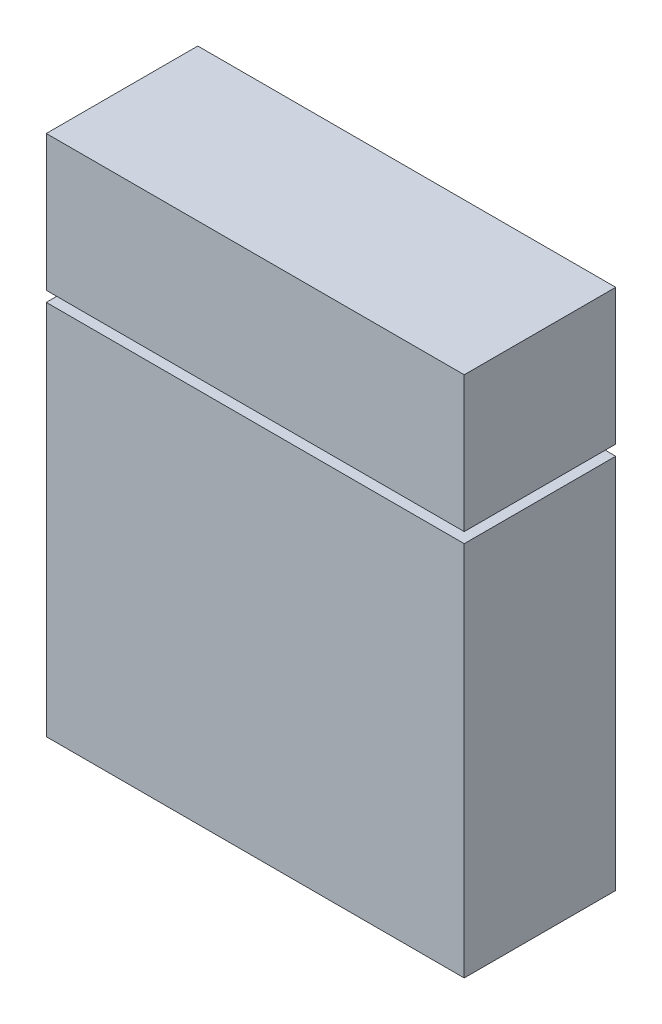
from build123d import *

# Parameters (mm, degrees)
SKETCH1_W           = 40
SKETCH1_H           = 14.5
BOSS_EXTRUDE1_DEPTH = 36
SHELL1_T            = -2
SKETCH3_W           = 40
SKETCH3_H           = 13
BOSS_EXTRUDE3_DEPTH = 14.5
SHELL2_T            = -1
SKETCH2_W           = 38
SKETCH2_H           = 12.5
SKETCH2_W_2         = 36
SKETCH2_H_2         = 10.5
BOSS_EXTRUDE2_DEPTH = 8
SKETCH4_W           = 2.411172945
SKETCH4_H           = 0.95890411
BOSS_EXTRUDE4_DEPTH = 0.6


with BuildPart() as part:
    # Sketch1 → Boss-Extrude1 (new body)
    with BuildSketch(Plane(origin=(0, 0, 0), x_dir=(1, 0, 0), z_dir=(0, 1, 0))):
        with Locations((20, 7.25)):
            Rectangle(SKETCH1_W, SKETCH1_H)
    extrude(amount=BOSS_EXTRUDE1_DEPTH)

    # Shell1
    shell1_openings = [part.faces().sort_by_distance(p)[0] for p in [
        (20, 36, -7.25),
    ]]
    offset(amount=SHELL1_T, openings=shell1_openings, kind=Kind.INTERSECTION)

    # Sketch2 → Boss-Extrude2 (add)
    with BuildSketch(Plane(origin=(0, 36, 0), x_dir=(1, 0, 0), z_dir=(0, 1, 0))):
        with Locations((20, 7.25)):
            Rectangle(SKETCH2_W, SKETCH2_H)
        with Locations((20, 7.25)):
            Rectangle(SKETCH2_W_2, SKETCH2_H_2, mode=Mode.SUBTRACT)
    extrude(amount=BOSS_EXTRUDE2_DEPTH)

    # Sketch4 → Boss-Extrude4 (add)
    # profile 1 of 13: a face of its own
    with BuildSketch(Plane(origin=(0, 0, -14.5), x_dir=(-1, 0, 0), z_dir=(0, 0, -1))):
        Polygon((-33.111087329, 25.911115248), (-31.298159247, 28.40576422), (-33.007277397, 30.842622097), (-31.609589041, 30.842622097), (-30.60359589, 29.373229974), (-29.590111301, 30.842622097), (-28.19135274, 30.842622097), (-29.90047089, 28.40576422), (-28.088613014, 25.911115248), (-29.493792808, 25.911115248), (-30.60359589, 27.4447197), (-31.705907534, 25.911115248), align=None)
    # profile 2 of 13: a face of its own
    with BuildSketch(Plane(origin=(0, 0, -14.5), x_dir=(-1, 0, 0), z_dir=(0, 0, -1))):
        with Locations((-26.664704624, 27.760430316)):
            Rectangle(SKETCH4_W, SKETCH4_H)
    # profile 3 of 13: a face of its own
    with BuildSketch(Plane(origin=(0, 0, -14.5), x_dir=(-1, 0, 0), z_dir=(0, 0, -1))):
        Polygon((-25.270761986, 25.911115248), (-23.400042808, 30.842622097), (-22.112585616, 30.842622097), (-20.240796233, 25.911115248), (-21.513270548, 25.911115248), (-21.809717466, 26.801526206), (-23.702910959, 26.801526206), (-23.999357877, 25.911115248), align=None)
        Polygon((-23.385059932, 27.760430316), (-22.127568493, 27.760430316), (-22.763270548, 29.608675179), align=None, mode=Mode.SUBTRACT)
    # profile 4 of 13: a face of its own
    with BuildSketch(Plane(origin=(0, 0, -14.5), x_dir=(-1, 0, 0), z_dir=(0, 0, -1))):
        with BuildLine():
            add(Edge.make_bspline(
                [(-17.441138699, 25.842622097), (-17.504319594, 25.843193709), (-17.628372588, 25.844316046), (-17.810813513, 25.860573692), (-17.986880937, 25.882935729), (-18.156032855, 25.917990004), (-18.318901219, 25.960200334), (-18.47507591, 26.012594344), (-18.623672758, 26.07638442), (-18.766570471, 26.147515716), (-18.900935636, 26.229171373), (-19.028485234, 26.318161499), (-19.146828485, 26.416751157), (-19.257463015, 26.522862991), (-19.359717753, 26.637038589), (-19.45400103, 26.759451881), (-19.54102985, 26.890071418), (-19.618545791, 27.029269857), (-19.688773597, 27.175108322), (-19.748239925, 27.328064232), (-19.798710374, 27.487558318), (-19.840432062, 27.652979125), (-19.872230804, 27.824988227), (-19.895982407, 28.003177736), (-19.910053127, 28.187925883), (-19.911506861, 28.313345771), (-19.912243151, 28.376868672)],
                knots=[0, 0, 0, 0, 1.134302944, 2.227155484, 3.287291634, 4.320127596, 5.327125488, 6.307730235, 7.275186614, 8.229313452, 9.172057786, 10.09635632, 11.020032909, 11.935339152, 12.84729825, 13.769974407, 14.708201451, 15.663424702, 16.629161195, 17.613088159, 18.607967803, 19.631982939, 20.674943435, 21.747780889, 22.859291827, 24, 24, 24, 24], degree=3))
            add(Edge.make_bspline(
                [(-19.912243151, 28.376868672), (-19.911661686, 28.440405398), (-19.910516642, 28.565524656), (-19.894291005, 28.749749349), (-19.871916865, 28.927945782), (-19.836909107, 29.09925222), (-19.794446192, 29.2645251), (-19.742531301, 29.423347725), (-19.678277513, 29.574624146), (-19.607230674, 29.720142734), (-19.526670907, 29.858490484), (-19.43803536, 29.989343936), (-19.340371384, 30.111413152), (-19.234999876, 30.2252785), (-19.12231325, 30.33140625), (-19.002325505, 30.430435582), (-18.873447028, 30.520521639), (-18.736439653, 30.601367514), (-18.592984345, 30.674511024), (-18.442709701, 30.73764837), (-18.286085101, 30.791226235), (-18.123356553, 30.834918872), (-17.954319692, 30.869313027), (-17.779220629, 30.893919505), (-17.597606317, 30.907578102), (-17.474693426, 30.909923556), (-17.412243151, 30.911115248)],
                knots=[0, 0, 0, 0, 1.137471579, 2.239958052, 3.309751485, 4.352183102, 5.368685638, 6.364684256, 7.341170057, 8.309744883, 9.263050222, 10.205742738, 11.137635889, 12.059909495, 12.981873265, 13.907856827, 14.843661702, 15.794695171, 16.754698838, 17.725294248, 18.711222551, 19.717008084, 20.740652763, 21.798649287, 22.881525306, 24, 24, 24, 24], degree=3))
            add(Edge.make_bspline(
                [(-17.412243151, 30.911115248), (-17.354429504, 30.909922137), (-17.240777073, 30.907576673), (-17.073027806, 30.89397778), (-16.911168182, 30.869066578), (-16.754836958, 30.835146284), (-16.604361283, 30.790945103), (-16.459187414, 30.737702842), (-16.320469642, 30.673104204), (-16.187240747, 30.600493534), (-16.061432354, 30.518577342), (-15.940957375, 30.431670981), (-15.830129759, 30.335606931), (-15.725206149, 30.234992947), (-15.62880588, 30.126134708), (-15.53931037, 30.01114128), (-15.456829525, 29.889511911), (-15.409255368, 29.803833511), (-15.385273973, 29.760644357)],
                knots=[0, 0, 0, 0, 1.130888133, 2.223146121, 3.288895887, 4.331788187, 5.349661884, 6.354150794, 7.35317223, 8.33993527, 9.319269624, 10.287806577, 11.242904509, 12.185379447, 13.129299661, 14.083964217, 15.034156054, 16, 16, 16, 16], degree=3))
            Line((-15.385273973, 29.760644357), (-16.421232877, 29.390353261))
            add(Edge.make_bspline(
                [(-16.421232877, 29.390353261), (-16.449434367, 29.438047974), (-16.504579819, 29.531310651), (-16.609283842, 29.652070339), (-16.729499241, 29.750850541), (-16.863492812, 29.825573931), (-17.00516507, 29.881553417), (-17.150258202, 29.922984438), (-17.29873729, 29.946697819), (-17.398608094, 29.95037124), (-17.448630137, 29.952211138)],
                knots=[0, 0, 0, 0, 1.077332688, 2.106626201, 3.093969042, 4.092635605, 5.08078461, 6.055063824, 7.025844628, 8, 8, 8, 8], degree=3))
            add(Edge.make_bspline(
                [(-17.448630137, 29.952211138), (-17.504452459, 29.949930065), (-17.614323997, 29.945440373), (-17.77556992, 29.910187966), (-17.928428786, 29.850374895), (-18.073652148, 29.768781211), (-18.207644108, 29.665096763), (-18.326677032, 29.538591331), (-18.430943293, 29.391653486), (-18.519493453, 29.224448198), (-18.590110412, 29.037886912), (-18.641490711, 28.833314785), (-18.670973679, 28.610672893), (-18.67509631, 28.456508657), (-18.677226027, 28.376868672)],
                knots=[0, 0, 0, 0, 0.897880113, 1.7672405, 2.64153505, 3.531005305, 4.43941526, 5.357247272, 6.316333764, 7.330870984, 8.393958058, 9.519093982, 10.718384218, 12, 12, 12, 12], degree=3))
            add(Edge.make_bspline(
                [(-18.677226027, 28.376868672), (-18.676374872, 28.314750078), (-18.674722867, 28.194184379), (-18.656968062, 28.019357006), (-18.62989286, 27.855642813), (-18.590065726, 27.703199369), (-18.540100702, 27.561517277), (-18.479181436, 27.430924756), (-18.405910995, 27.312006287), (-18.321051329, 27.205775634), (-18.229686169, 27.109870915), (-18.130193527, 27.028860885), (-18.027376449, 26.958035299), (-17.918447865, 26.901750692), (-17.805373859, 26.8552427), (-17.68596601, 26.825472564), (-17.562066118, 26.804922703), (-17.477613259, 26.802670273), (-17.434717466, 26.801526206)],
                knots=[0, 0, 0, 0, 1.321923538, 2.565715426, 3.736787918, 4.851159748, 5.915232172, 6.93097327, 7.913055684, 8.880852609, 9.820715951, 10.726934296, 11.60736189, 12.473558546, 13.332366679, 14.203608668, 15.087566354, 16, 16, 16, 16], degree=3))
            add(Edge.make_bspline(
                [(-17.434717466, 26.801526206), (-17.387197421, 26.803079073), (-17.291336609, 26.806211624), (-17.146494436, 26.82857456), (-16.999774743, 26.865465686), (-16.852252291, 26.915113527), (-16.709506327, 26.984356125), (-16.582216006, 27.081346079), (-16.469956383, 27.202221813), (-16.413102553, 27.297951057), (-16.383775685, 27.347331001)],
                knots=[0, 0, 0, 0, 0.91565894, 1.8471323, 2.81759887, 3.828618231, 4.843254429, 5.859403534, 6.895817748, 8, 8, 8, 8], degree=3))
            Line((-16.383775685, 27.347331001), (-15.355308219, 26.9759697))
            add(Edge.make_bspline(
                [(-15.355308219, 26.9759697), (-15.380692787, 26.933089767), (-15.431103832, 26.847934797), (-15.518231614, 26.728012864), (-15.61010549, 26.612756914), (-15.713388626, 26.507435265), (-15.820880419, 26.405711554), (-15.938399421, 26.312610056), (-16.063580233, 26.226442315), (-16.194899308, 26.145782234), (-16.332905713, 26.074179243), (-16.47666579, 26.011955186), (-16.625504857, 25.959658715), (-16.779197642, 25.91664519), (-16.93760855, 25.883506529), (-17.101013587, 25.860489636), (-17.269227772, 25.844395436), (-17.383308509, 25.843218641), (-17.441138699, 25.842622097)],
                knots=[0, 0, 0, 0, 0.959546369, 1.905556723, 2.853412952, 3.796472408, 4.744801998, 5.703363206, 6.681439113, 7.671611824, 8.670713748, 9.674297559, 10.68729874, 11.707896229, 12.747207531, 13.802822661, 14.886199502, 16, 16, 16, 16], degree=3))
        make_face()
    # profile 5 of 13: a face of its own
    with BuildSketch(Plane(origin=(0, 0, -14.5), x_dir=(-1, 0, 0), z_dir=(0, 0, -1))):
        Polygon((-13.469606164, 25.911115248), (-13.469606164, 29.815224837), (-15.059931507, 29.815224837), (-15.059931507, 30.842622097), (-10.718107877, 30.842622097), (-10.718107877, 29.815224837), (-12.308433219, 29.815224837), (-12.308433219, 25.911115248), align=None)
    # profile 6 of 13: a face of its own
    with BuildSketch(Plane(origin=(0, 0, -14.5), x_dir=(-1, 0, 0), z_dir=(0, 0, -1))):
        with BuildLine():
            add(Edge.make_bspline(
                [(-7.764340753, 25.842622097), (-7.826435684, 25.843807607), (-7.948638756, 25.846140695), (-8.129167343, 25.859884761), (-8.304028254, 25.884284407), (-8.473176931, 25.920179835), (-8.637398821, 25.963717531), (-8.796358201, 26.017152564), (-8.949324975, 26.081421204), (-9.096041889, 26.155520523), (-9.236371271, 26.23778657), (-9.369366697, 26.328586668), (-9.493621484, 26.428716653), (-9.610566526, 26.535911883), (-9.71997722, 26.650382585), (-9.821072816, 26.773160431), (-9.914276598, 26.904112675), (-9.999723134, 27.042654814), (-10.075719809, 27.188640343), (-10.142515695, 27.340742245), (-10.197614843, 27.499516083), (-10.24412335, 27.663399483), (-10.279074722, 27.833379635), (-10.304990656, 28.009127999), (-10.319903705, 28.191107736), (-10.322093112, 28.314413736), (-10.323202055, 28.376868672)],
                knots=[0, 0, 0, 0, 1.103579979, 2.171849834, 3.215473578, 4.238776472, 5.242989064, 6.233378138, 7.216537329, 8.189029907, 9.152386999, 10.105488514, 11.048073661, 11.985870825, 12.923067772, 13.859814304, 14.809790056, 15.777518025, 16.750155247, 17.73247601, 18.726995941, 19.734564975, 20.757867869, 21.808668853, 22.890082825, 24, 24, 24, 24], degree=3))
            add(Edge.make_bspline(
                [(-10.323202055, 28.376868672), (-10.322093357, 28.439323695), (-10.319904433, 28.562629865), (-10.304987866, 28.744608362), (-10.279084752, 28.920361247), (-10.244087193, 29.090325107), (-10.197838463, 29.253943836), (-10.142265275, 29.41219234), (-10.075754028, 29.564040765), (-9.999700003, 29.709996983), (-9.914334448, 29.848601378), (-9.820709143, 29.979563076), (-9.72036847, 30.103325705), (-9.610464895, 30.21771969), (-9.493992057, 30.325123568), (-9.36898823, 30.423962752), (-9.236426398, 30.514952897), (-9.096019184, 30.597104346), (-8.949360375, 30.671343041), (-8.79613147, 30.735208234), (-8.637631239, 30.790344242), (-8.473143679, 30.833460246), (-8.304037422, 30.869479755), (-8.129164816, 30.893845191), (-7.948639419, 30.907598588), (-7.826435907, 30.909930391), (-7.764340753, 30.911115248)],
                knots=[0, 0, 0, 0, 1.110055208, 2.191603668, 3.242535334, 4.265965488, 5.273659827, 6.262323585, 7.244766512, 8.217524695, 9.185373013, 10.135466908, 11.077230586, 12.014544085, 12.952457877, 13.891207151, 14.844427197, 15.807904095, 16.780517616, 17.763799076, 18.756358901, 19.76069638, 20.784126535, 21.827880067, 22.896282776, 24, 24, 24, 24], degree=3))
            add(Edge.make_bspline(
                [(-7.764340753, 30.911115248), (-7.701889317, 30.909923156), (-7.578618466, 30.907570127), (-7.396314455, 30.893834484), (-7.219648448, 30.869559601), (-7.049430816, 30.833634694), (-6.884349552, 30.790116361), (-6.72533158, 30.735453082), (-6.571837932, 30.671315433), (-6.425175818, 30.597101956), (-6.28473622, 30.514989131), (-6.152074122, 30.423663849), (-6.026175369, 30.325124609), (-5.908588838, 30.218089145), (-5.798723388, 30.102981715), (-5.697305091, 29.979592109), (-5.602425487, 29.848944769), (-5.517421792, 29.709687083), (-5.439992568, 29.564126807), (-5.372635255, 29.412186455), (-5.315510475, 29.254178738), (-5.270038665, 29.090148453), (-5.233148278, 28.920523552), (-5.207753495, 28.744583598), (-5.192694542, 28.562636323), (-5.190525166, 28.439325866), (-5.18942637, 28.376868672)],
                knots=[0, 0, 0, 0, 1.106823481, 2.184722734, 3.237959271, 4.264599291, 5.266012822, 6.261662314, 7.242081126, 8.211863057, 9.172534965, 10.122979882, 11.063957728, 12.003809277, 12.938393956, 13.881429653, 14.832442119, 15.797472721, 16.770340844, 17.752470401, 18.740382193, 19.74514281, 20.766904726, 21.814776793, 22.893176519, 24, 24, 24, 24], degree=3))
            add(Edge.make_bspline(
                [(-5.18942637, 28.376868672), (-5.190525416, 28.314411568), (-5.192695283, 28.191101287), (-5.207750653, 28.009152726), (-5.233158501, 27.833217461), (-5.270001781, 27.663575654), (-5.315734834, 27.499283164), (-5.372381765, 27.340745343), (-5.440027334, 27.18855474), (-5.517398572, 27.042964505), (-5.602483169, 26.903769637), (-5.69694021, 26.773127333), (-5.799113147, 26.650728597), (-5.908487417, 26.535541762), (-6.026545743, 26.428719217), (-6.151697996, 26.328884536), (-6.284790877, 26.237750315), (-6.425153344, 26.15552307), (-6.571872879, 26.081448195), (-6.725106809, 26.016908983), (-6.884579933, 25.963943958), (-7.049397795, 25.920005404), (-7.219657636, 25.884204802), (-7.396311915, 25.859895383), (-7.578619127, 25.846169164), (-7.701889539, 25.843814843), (-7.764340753, 25.842622097)],
                knots=[0, 0, 0, 0, 1.106686263, 2.184952294, 3.232694451, 4.254329694, 5.258965746, 6.252704014, 7.234711811, 8.207459324, 9.172370285, 10.12326485, 11.06131876, 11.995787575, 12.935522606, 13.880304198, 14.830631284, 15.791184092, 16.760845795, 17.74114306, 18.734640031, 19.735929413, 20.762442155, 21.815548117, 22.893313737, 24, 24, 24, 24], degree=3))
        make_face()
        with BuildLine():
            add(Edge.make_bspline(
                [(-7.764340753, 26.801526206), (-7.704938985, 26.803318569), (-7.587604506, 26.806858968), (-7.416089564, 26.843067918), (-7.251764804, 26.898591453), (-7.095901595, 26.977121272), (-6.951383074, 27.0775307), (-6.820892511, 27.20029185), (-6.707745718, 27.345367221), (-6.608088058, 27.509817116), (-6.529023219, 27.696759522), (-6.470973766, 27.904791701), (-6.438749764, 28.134357102), (-6.434263408, 28.294007883), (-6.431934932, 28.376868672)],
                knots=[0, 0, 0, 0, 0.921217794, 1.819653054, 2.709560437, 3.608832094, 4.52008632, 5.433157136, 6.379611243, 7.368572108, 8.410889379, 9.521064577, 10.713400929, 12, 12, 12, 12], degree=3))
            add(Edge.make_bspline(
                [(-6.431934932, 28.376868672), (-6.434261098, 28.459731033), (-6.438743006, 28.619384842), (-6.470997799, 28.848929284), (-6.528941935, 29.057033152), (-6.608485668, 29.244013726), (-6.70697238, 29.409302437), (-6.82172385, 29.553373402), (-6.950600463, 29.677509011), (-7.096323377, 29.776391525), (-7.251701619, 29.855229246), (-7.416106504, 29.910647078), (-7.587600128, 29.946884152), (-7.704937513, 29.950420716), (-7.764340753, 29.952211138)],
                knots=[0, 0, 0, 0, 1.286484825, 2.478715302, 3.588791919, 4.631016636, 5.624640673, 6.566672884, 7.483468754, 8.391488359, 9.290680163, 10.180508525, 11.078864007, 12, 12, 12, 12], degree=3))
            add(Edge.make_bspline(
                [(-7.764340753, 29.952211138), (-7.822680002, 29.950434034), (-7.937908747, 29.946923989), (-8.106839904, 29.91034968), (-8.269715894, 29.854952896), (-8.424793454, 29.776785887), (-8.569636836, 29.676778595), (-8.699514434, 29.55381747), (-8.814176841, 29.409238794), (-8.912637838, 29.24401032), (-8.992545876, 29.05720975), (-9.048747338, 28.848728232), (-9.081486026, 28.619414781), (-9.085896065, 28.459741263), (-9.088184932, 28.376868672)],
                knots=[0, 0, 0, 0, 0.907584157, 1.792614509, 2.680171409, 3.582379695, 4.488874192, 5.41278275, 6.357975157, 7.354932463, 8.400653488, 9.512969455, 10.709199458, 12, 12, 12, 12], degree=3))
            add(Edge.make_bspline(
                [(-9.088184932, 28.376868672), (-9.085893758, 28.293997653), (-9.081479274, 28.134327163), (-9.048771336, 27.904992763), (-8.992464789, 27.696582838), (-8.913035805, 27.509820386), (-8.813404067, 27.345430739), (-8.700346905, 27.199843889), (-8.568854154, 27.078261678), (-8.425217186, 26.976727228), (-8.269652772, 26.898867387), (-8.106856553, 26.843365789), (-7.937904466, 26.80681898), (-7.822678563, 26.803305201), (-7.764340753, 26.801526206)],
                knots=[0, 0, 0, 0, 1.290912043, 2.487245376, 3.599657426, 4.645468781, 5.637744867, 6.587371702, 7.507557596, 8.417310857, 9.319597076, 10.207230643, 11.092337445, 12, 12, 12, 12], degree=3))
        make_face(mode=Mode.SUBTRACT)
    # profile 7 of 13: a face of its own
    with BuildSketch(Plane(origin=(0, 0, -14.5), x_dir=(-1, 0, 0), z_dir=(0, 0, -1))):
        Polygon((-24.077482877, 15.733033056), (-23.943707192, 16.691937165), (-24.890839041, 16.691937165), (-24.743150685, 17.719334426), (-23.796018836, 17.719334426), (-23.648330479, 18.678238535), (-24.595462329, 18.678238535), (-24.446703767, 19.705635795), (-23.500642123, 19.705635795), (-23.359375, 20.664539905), (-22.324486301, 20.664539905), (-22.464683219, 19.705635795), (-21.45119863, 19.705635795), (-21.311001712, 20.664539905), (-20.26755137, 20.664539905), (-20.407748288, 19.705635795), (-19.454195205, 19.705635795), (-19.609375, 18.678238535), (-20.556506849, 18.678238535), (-20.696703767, 17.719334426), (-19.749571918, 17.719334426), (-19.898330479, 16.691937165), (-20.851883562, 16.691937165), (-20.985659247, 15.733033056), (-22.028039384, 15.733033056), (-21.895333904, 16.691937165), (-22.901327055, 16.691937165), (-23.034032534, 15.733033056), align=None)
        Polygon((-22.753638699, 17.719334426), (-21.74015411, 17.719334426), (-21.598886986, 18.678238535), (-22.612371575, 18.678238535), align=None, mode=Mode.SUBTRACT)
    # profile 8 of 13: a face of its own
    with BuildSketch(Plane(origin=(0, 0, -14.5), x_dir=(-1, 0, 0), z_dir=(0, 0, -1))):
        with BuildLine():
            Line((-18.995077055, 15.733033056), (-18.995077055, 16.623444015))
            add(Edge.make_bspline(
                [(-18.995077055, 16.623444015), (-18.915831423, 16.679022575), (-18.760975158, 16.787630308), (-18.535222887, 16.947762501), (-18.322687406, 17.102122403), (-18.121656668, 17.248255294), (-17.935104117, 17.390273037), (-17.758708923, 17.523173003), (-17.596808595, 17.652342733), (-17.444642404, 17.772805752), (-17.305424902, 17.890266103), (-17.175453548, 18.002490657), (-17.055600871, 18.111364164), (-16.946165007, 18.217169348), (-16.847894167, 18.320181266), (-16.758514205, 18.418599554), (-16.679401056, 18.513425329), (-16.610094021, 18.605215158), (-16.549789329, 18.694565506), (-16.496999401, 18.782124104), (-16.452794212, 18.868961477), (-16.417628745, 18.954705537), (-16.389599733, 19.038338452), (-16.368524155, 19.12045507), (-16.356723128, 19.201580842), (-16.354769414, 19.255402319), (-16.353809932, 19.281834426)],
                knots=[0, 0, 0, 0, 1.811704495, 3.540306081, 5.180447559, 6.728302311, 8.191933421, 9.568797882, 10.861886385, 12.068396724, 13.201168436, 14.27088458, 15.282375238, 16.231490338, 17.119321911, 17.946665833, 18.719512314, 19.429959585, 20.098506126, 20.736337521, 21.342523323, 21.920355032, 22.469342971, 22.992422251, 23.505171484, 24, 24, 24, 24], degree=3))
            add(Edge.make_bspline(
                [(-16.353809932, 19.281834426), (-16.356033021, 19.326734777), (-16.360305113, 19.413019391), (-16.399633915, 19.533417762), (-16.465121214, 19.636731792), (-16.556593926, 19.717747881), (-16.662594901, 19.781173743), (-16.77871373, 19.828302654), (-16.90412713, 19.854930353), (-16.9904613, 19.858828791), (-17.034460616, 19.86081559)],
                knots=[0, 0, 0, 0, 1.0714191, 2.058936774, 2.99144009, 3.963690835, 4.951392785, 5.935291678, 6.947742779, 8, 8, 8, 8], degree=3))
            add(Edge.make_bspline(
                [(-17.034460616, 19.86081559), (-17.072753373, 19.859059292), (-17.149755698, 19.855527578), (-17.264481778, 19.829935706), (-17.377431445, 19.787290419), (-17.469485004, 19.739898311), (-17.540897761, 19.693132428), (-17.588896689, 19.647865347), (-17.634332736, 19.598108571), (-17.673880479, 19.539979486), (-17.710761698, 19.476032299), (-17.741048549, 19.403813808), (-17.768326213, 19.325259281), (-17.781921785, 19.269838606), (-17.788955479, 19.241166617)],
                knots=[0, 0, 0, 0, 1.292999032, 2.600072241, 3.949832351, 5.361949882, 6.090579869, 6.824175362, 7.583737363, 8.362648952, 9.193694582, 10.073461348, 11.003301643, 12, 12, 12, 12], degree=3))
            Line((-17.788955479, 19.241166617), (-18.809931507, 19.60503648))
            add(Edge.make_bspline(
                [(-18.809931507, 19.60503648), (-18.792485512, 19.649599799), (-18.758105679, 19.737418201), (-18.694291032, 19.861816562), (-18.622230622, 19.978958201), (-18.539766235, 20.087191991), (-18.449758857, 20.189055555), (-18.349351488, 20.280944335), (-18.240835076, 20.366140876), (-18.123215884, 20.442794463), (-17.998572724, 20.510863768), (-17.868262946, 20.569967635), (-17.733070188, 20.620294703), (-17.592995627, 20.662086399), (-17.447806211, 20.694406252), (-17.297541712, 20.716291294), (-17.14213035, 20.73098121), (-17.03663585, 20.732342245), (-16.983090753, 20.733033056)],
                knots=[0, 0, 0, 0, 1.00036352, 1.971359609, 2.91961612, 3.873141413, 4.813705766, 5.758786908, 6.715488637, 7.696381028, 8.691388109, 9.683060792, 10.686424742, 11.706215145, 12.738025682, 13.794256734, 14.880446488, 16, 16, 16, 16], degree=3))
            add(Edge.make_bspline(
                [(-16.983090753, 20.733033056), (-16.901304472, 20.730962293), (-16.741403087, 20.726913719), (-16.508224531, 20.695773353), (-16.288231454, 20.642872742), (-16.081666341, 20.571135344), (-15.892218426, 20.478207739), (-15.72113094, 20.366739434), (-15.574081039, 20.232395274), (-15.468264636, 20.106233876), (-15.396821055, 19.995934348), (-15.349265746, 19.908652631), (-15.311621544, 19.815454575), (-15.277292318, 19.719567618), (-15.253577273, 19.618179538), (-15.234919219, 19.512860111), (-15.224180746, 19.402635233), (-15.223134635, 19.327518792), (-15.22260274, 19.289325864)],
                knots=[0, 0, 0, 0, 1.530556104, 2.992409433, 4.393319662, 5.759685909, 7.076619037, 8.33409609, 9.567949726, 10.791370236, 11.40440925, 12.02579177, 12.648321283, 13.283927523, 13.930108215, 14.594255026, 15.285249454, 16, 16, 16, 16], degree=3))
            add(Edge.make_bspline(
                [(-15.22260274, 19.289325864), (-15.224460553, 19.227503107), (-15.228164348, 19.104251289), (-15.25794653, 18.921107893), (-15.307617887, 18.741547715), (-15.376676988, 18.565213156), (-15.464788531, 18.392403927), (-15.573150211, 18.223293398), (-15.700597143, 18.057519786), (-15.848319986, 17.896033495), (-16.013270544, 17.737487942), (-16.190316216, 17.576316934), (-16.383701778, 17.417514216), (-16.590426852, 17.257596863), (-16.812134152, 17.09863491), (-17.047889277, 16.938918405), (-17.298183627, 16.779585341), (-17.471553708, 16.676164315), (-17.559931507, 16.623444015)],
                knots=[0, 0, 0, 0, 0.800579642, 1.596061063, 2.39657401, 3.21014667, 4.045133991, 4.905368571, 5.808443174, 6.750683216, 7.737647826, 8.771598012, 9.851468923, 10.978270572, 12.156948619, 13.384888121, 14.666910507, 16, 16, 16, 16], degree=3))
            Line((-17.559931507, 16.623444015), (-15.200128425, 16.623444015))
            Line((-15.200128425, 16.623444015), (-15.200128425, 15.733033056))
            Line((-15.200128425, 15.733033056), (-18.995077055, 15.733033056))
        make_face()
    # profile 9 of 13: a face of its own
    with BuildSketch(Plane(origin=(0, 0, -14.5), x_dir=(-1, 0, 0), z_dir=(0, 0, -1))):
        with BuildLine():
            Line((-28.466395548, 5.162185453), (-29.273330479, 5.923101549))
            add(Edge.make_bspline(
                [(-29.273330479, 5.923101549), (-29.326879317, 5.887696934), (-29.434245553, 5.816710141), (-29.608195914, 5.73083788), (-29.787507183, 5.653398663), (-29.976644974, 5.593008582), (-30.173461795, 5.543992218), (-30.379530817, 5.512530392), (-30.593078315, 5.48924837), (-30.738373901, 5.487398662), (-30.812285959, 5.486457713)],
                knots=[0, 0, 0, 0, 0.947512456, 1.899776943, 2.861041691, 3.831065722, 4.829412731, 5.854447791, 6.90855474, 8, 8, 8, 8], degree=3))
            add(Edge.make_bspline(
                [(-30.812285959, 5.486457713), (-30.874380889, 5.487643223), (-30.996583961, 5.489976311), (-31.177112549, 5.503720377), (-31.35197346, 5.528120024), (-31.521122136, 5.564015451), (-31.685344026, 5.607553147), (-31.844303407, 5.66098818), (-31.99727018, 5.72525682), (-32.143987094, 5.79935614), (-32.284316476, 5.881622186), (-32.417311903, 5.972422285), (-32.54156669, 6.07255227), (-32.658511732, 6.1797475), (-32.767922425, 6.294218202), (-32.869018021, 6.416996048), (-32.962221803, 6.547948291), (-33.047668339, 6.68649043), (-33.123665014, 6.832475959), (-33.1904609, 6.984577861), (-33.245560049, 7.143351699), (-33.292068555, 7.307235099), (-33.327019927, 7.477215252), (-33.352935862, 7.652963615), (-33.367848911, 7.834943352), (-33.370038318, 7.958249352), (-33.37114726, 8.020704289)],
                knots=[0, 0, 0, 0, 1.103579979, 2.171849834, 3.215473578, 4.238776472, 5.242989064, 6.233378138, 7.216537329, 8.189029907, 9.152386999, 10.105488514, 11.048073661, 11.985870825, 12.923067772, 13.859814304, 14.809790056, 15.777518025, 16.750155247, 17.73247601, 18.726995941, 19.734564975, 20.757867869, 21.808668853, 22.890082825, 24, 24, 24, 24], degree=3))
            add(Edge.make_bspline(
                [(-33.37114726, 8.020704289), (-33.370038562, 8.083159311), (-33.367849638, 8.206465482), (-33.352933071, 8.388443978), (-33.327029958, 8.564196864), (-33.292032398, 8.734160723), (-33.245783668, 8.897779452), (-33.19021048, 9.056027957), (-33.123699233, 9.207876382), (-33.047645209, 9.3538326), (-32.962279654, 9.492436995), (-32.868654349, 9.623398693), (-32.768313676, 9.747161322), (-32.6584101, 9.861555307), (-32.541937262, 9.968959184), (-32.416933436, 10.067798368), (-32.284371603, 10.158788514), (-32.143964389, 10.240939962), (-31.99730558, 10.315178658), (-31.844076676, 10.37904385), (-31.685576444, 10.434179859), (-31.521088884, 10.477295862), (-31.351982628, 10.513315371), (-31.177110021, 10.537680807), (-30.996584624, 10.551434205), (-30.874381112, 10.553766007), (-30.812285959, 10.554950864)],
                knots=[0, 0, 0, 0, 1.110055208, 2.191603668, 3.242535334, 4.265965488, 5.273659827, 6.262323585, 7.244766512, 8.217524695, 9.185373013, 10.135466908, 11.077230586, 12.014544085, 12.952457877, 13.891207151, 14.844427197, 15.807904095, 16.780517616, 17.763799076, 18.756358901, 19.76069638, 20.784126535, 21.827880067, 22.896282776, 24, 24, 24, 24], degree=3))
            add(Edge.make_bspline(
                [(-30.812285959, 10.554950864), (-30.749837335, 10.553746269), (-30.626572035, 10.551368557), (-30.44422753, 10.537812949), (-30.267780691, 10.512888302), (-30.097006491, 10.479339412), (-29.932731522, 10.433200242), (-29.773022027, 10.380783284), (-29.619822443, 10.316097823), (-29.473110395, 10.242040575), (-29.332685152, 10.159885536), (-29.200014956, 10.068574964), (-29.074134239, 9.970018661), (-28.956483881, 9.863036659), (-28.847044496, 9.747931982), (-28.744889576, 9.625510941), (-28.65042576, 9.494875441), (-28.565350105, 9.355675962), (-28.487949607, 9.21009739), (-28.420549868, 9.058171342), (-28.363684122, 8.900447705), (-28.317635735, 8.736569208), (-28.281258104, 8.566817695), (-28.25573984, 8.390917582), (-28.24060446, 8.209327943), (-28.238460592, 8.086372412), (-28.237371575, 8.023914905)],
                knots=[0, 0, 0, 0, 1.107409942, 2.18588033, 3.239674935, 4.265592185, 5.269192217, 6.263338852, 7.244277149, 8.214572929, 9.175753858, 10.126702377, 11.068178809, 12.008528347, 12.943608226, 13.882275544, 14.833791913, 15.799333846, 16.772717453, 17.7553674, 18.743802647, 19.743007564, 20.771495648, 21.81992294, 22.892590058, 24, 24, 24, 24], degree=3))
            add(Edge.make_bspline(
                [(-28.237371575, 8.023914905), (-28.238466487, 7.954298473), (-28.240616296, 7.817609698), (-28.261728133, 7.615890082), (-28.295547607, 7.421656475), (-28.343028202, 7.23475676), (-28.401648358, 7.055912638), (-28.472033731, 6.885488644), (-28.549950094, 6.721565187), (-28.612797814, 6.619292081), (-28.644049658, 6.568435453)],
                knots=[0, 0, 0, 0, 1.090516086, 2.141179955, 3.174118813, 4.177349538, 5.160159568, 6.120327392, 7.065308424, 8, 8, 8, 8], degree=3))
            Line((-28.644049658, 6.568435453), (-27.853167808, 5.820361823))
            Line((-27.853167808, 5.820361823), (-28.466395548, 5.162185453))
        make_face()
        with BuildLine():
            add(Edge.make_bspline(
                [(-30.812285959, 6.445361823), (-30.777655235, 6.445888203), (-30.7092916, 6.446927318), (-30.608368454, 6.457898605), (-30.510790466, 6.476205601), (-30.416422433, 6.500967857), (-30.3246297, 6.531474621), (-30.237158521, 6.571852078), (-30.152086712, 6.617500054), (-30.098545808, 6.653251602), (-30.071703767, 6.671175179)],
                knots=[0, 0, 0, 0, 1.055927496, 2.084479692, 3.091747993, 4.081408564, 5.058609478, 6.037444559, 7.016098201, 8, 8, 8, 8], degree=3))
            Line((-30.071703767, 6.671175179), (-31.130136986, 7.660045042))
            Line((-31.130136986, 7.660045042), (-30.515839041, 8.29253648))
            Line((-30.515839041, 8.29253648), (-29.561215753, 7.412827576))
            add(Edge.make_bspline(
                [(-29.561215753, 7.412827576), (-29.547731555, 7.459690442), (-29.520530533, 7.554224633), (-29.497634652, 7.702618605), (-29.481509554, 7.857666038), (-29.480433365, 7.963935036), (-29.479880137, 8.018563878)],
                knots=[0, 0, 0, 0, 0.952958847, 1.922357748, 2.931963311, 4, 4, 4, 4], degree=3))
            add(Edge.make_bspline(
                [(-29.479880137, 8.018563878), (-29.482192365, 8.101783208), (-29.486638241, 8.261794542), (-29.518936396, 8.491701004), (-29.576911198, 8.699777258), (-29.656348169, 8.886852002), (-29.755348623, 9.052055356), (-29.868876435, 9.197258013), (-29.999318081, 9.320048345), (-30.143849492, 9.420450084), (-30.299709301, 9.498981931), (-30.464034959, 9.55450493), (-30.635549662, 9.590714023), (-30.752884174, 9.594254402), (-30.812285959, 9.596046754)],
                knots=[0, 0, 0, 0, 1.291025862, 2.482341189, 3.591565718, 4.632990429, 5.625851765, 6.571495402, 7.483784334, 8.394258232, 9.292759822, 10.181905157, 11.079571066, 12, 12, 12, 12], degree=3))
            add(Edge.make_bspline(
                [(-30.812285959, 9.596046754), (-30.870625208, 9.594269651), (-30.985853953, 9.590759606), (-31.15478511, 9.554185296), (-31.317661099, 9.498788512), (-31.47273866, 9.420621503), (-31.617582041, 9.320614211), (-31.747459639, 9.197653086), (-31.862122046, 9.05307441), (-31.960583044, 8.887845937), (-32.040491081, 8.701045367), (-32.096692543, 8.492563848), (-32.129431231, 8.263250398), (-32.13384127, 8.103576879), (-32.136130137, 8.020704289)],
                knots=[0, 0, 0, 0, 0.907584157, 1.792614509, 2.680171409, 3.582379695, 4.488874192, 5.41278275, 6.357975157, 7.354932463, 8.400653488, 9.512969455, 10.709199458, 12, 12, 12, 12], degree=3))
            add(Edge.make_bspline(
                [(-32.136130137, 8.020704289), (-32.133838964, 7.93783327), (-32.12942448, 7.778162779), (-32.096716541, 7.548828379), (-32.040409995, 7.340418455), (-31.96098101, 7.153656003), (-31.861349272, 6.989266356), (-31.748292111, 6.843679505), (-31.61679936, 6.722097295), (-31.473162391, 6.620562844), (-31.317597978, 6.542703003), (-31.154801759, 6.487201405), (-30.985849672, 6.450654597), (-30.870623769, 6.447140817), (-30.812285959, 6.445361823)],
                knots=[0, 0, 0, 0, 1.290912043, 2.487245376, 3.599657426, 4.645468781, 5.637744867, 6.587371702, 7.507557596, 8.417310857, 9.319597076, 10.207230643, 11.092337445, 12, 12, 12, 12], degree=3))
        make_face(mode=Mode.SUBTRACT)
    # profile 10 of 13: a face of its own
    with BuildSketch(Plane(origin=(0, 0, -14.5), x_dir=(-1, 0, 0), z_dir=(0, 0, -1))):
        Polygon((-26.175085616, 5.554950864), (-26.175085616, 9.459060453), (-27.765410959, 9.459060453), (-27.765410959, 10.486457713), (-23.423587329, 10.486457713), (-23.423587329, 9.459060453), (-25.013912671, 9.459060453), (-25.013912671, 5.554950864), align=None)
    # profile 11 of 13: a face of its own
    with BuildSketch(Plane(origin=(0, 0, -14.5), x_dir=(-1, 0, 0), z_dir=(0, 0, -1))):
        Polygon((-21.327054795, 5.554950864), (-21.327054795, 7.446003946), (-23.213827055, 10.486457713), (-21.852525685, 10.486457713), (-20.750214041, 8.545104974), (-19.647902397, 10.486457713), (-18.280179795, 10.486457713), (-20.165881849, 7.446003946), (-20.165881849, 5.554950864), align=None)
    # profile 12 of 13: a face of its own
    with BuildSketch(Plane(origin=(0, 0, -14.5), x_dir=(-1, 0, 0), z_dir=(0, 0, -1))):
        with BuildLine():
            add(Edge.make_bspline(
                [(-13.447131849, 5.486457713), (-13.504950497, 5.487168269), (-13.61791123, 5.488556488), (-13.78308971, 5.502621056), (-13.939925332, 5.526323686), (-14.088427818, 5.557949754), (-14.228749606, 5.598781549), (-14.36048592, 5.648499833), (-14.48315238, 5.709338128), (-14.598140316, 5.777418921), (-14.704354093, 5.855520769), (-14.803851462, 5.939491945), (-14.895747233, 6.031579694), (-14.980029854, 6.130587388), (-15.056348123, 6.237657958), (-15.125820022, 6.350955424), (-15.188602071, 6.471617517), (-15.242344182, 6.600178227), (-15.290669012, 6.734385447), (-15.330733505, 6.874450703), (-15.366882731, 7.018752063), (-15.393669112, 7.16874187), (-15.416735773, 7.323190914), (-15.432448029, 7.482843144), (-15.442348741, 7.647432434), (-15.443534995, 7.758846214), (-15.444135274, 7.815224837)],
                knots=[0, 0, 0, 0, 1.188343888, 2.321676533, 3.404413645, 4.447201803, 5.440413434, 6.406006804, 7.337412485, 8.251715473, 9.149398781, 10.044232055, 10.925745011, 11.820578285, 12.713968084, 13.625797432, 14.550714017, 15.506877183, 16.488022697, 17.481234328, 18.500367387, 19.544572744, 20.611726493, 21.709899298, 22.841142237, 24, 24, 24, 24], degree=3))
            add(Edge.make_bspline(
                [(-15.444135274, 7.815224837), (-15.442742368, 7.902320719), (-15.439974723, 8.075376638), (-15.416338335, 8.332580017), (-15.380635266, 8.58535858), (-15.329249418, 8.832456703), (-15.263589551, 9.071581834), (-15.176661717, 9.298293785), (-15.075659274, 9.513050617), (-14.956748666, 9.713892025), (-14.820372382, 9.8991421), (-14.662421764, 10.063967934), (-14.486441704, 10.209378902), (-14.324281426, 10.311578812), (-14.186600439, 10.383557649), (-14.076449322, 10.429039039), (-13.960905271, 10.467777729), (-13.840482187, 10.49984329), (-13.714544193, 10.524163982), (-13.583500218, 10.542606218), (-13.446957995, 10.553360395), (-13.354042667, 10.554415785), (-13.306934932, 10.554950864)],
                knots=[0, 0, 0, 0, 1.332879186, 2.64837587, 3.950328514, 5.238617878, 6.509196352, 7.741366765, 8.950380168, 10.137807309, 11.308519441, 12.463294749, 13.623171043, 14.794112364, 15.389993946, 15.999455728, 16.615897748, 17.254294525, 17.905385341, 18.577987169, 19.279044633, 20, 20, 20, 20], degree=3))
            add(Edge.make_bspline(
                [(-13.306934932, 10.554950864), (-13.260895804, 10.55438927), (-13.170853445, 10.553290916), (-13.039109742, 10.543118124), (-12.912947682, 10.528491508), (-12.792460902, 10.507292466), (-12.677662806, 10.479576211), (-12.568944249, 10.445250016), (-12.466153773, 10.40437588), (-12.337734751, 10.343916488), (-12.190635923, 10.255516478), (-12.035239889, 10.130529419), (-11.901692639, 9.989542283), (-11.832431792, 9.882600399), (-11.797945205, 9.829351549)],
                knots=[0, 0, 0, 0, 0.944067042, 1.846386504, 2.708508369, 3.548107764, 4.353739547, 5.128895153, 5.884290526, 6.620667907, 8.038534542, 9.391410473, 10.70112262, 12, 12, 12, 12], degree=3))
            Line((-11.797945205, 9.829351549), (-12.803938356, 9.479394357))
            add(Edge.make_bspline(
                [(-12.803938356, 9.479394357), (-12.817191501, 9.498842394), (-12.844119588, 9.538357424), (-12.897710541, 9.588463181), (-12.960917968, 9.631940153), (-13.033812635, 9.667272314), (-13.113042673, 9.697663643), (-13.19849555, 9.71712071), (-13.28794078, 9.730858752), (-13.349329869, 9.732296504), (-13.38077911, 9.733033056)],
                knots=[0, 0, 0, 0, 0.858141074, 1.743593443, 2.662413841, 3.653881747, 4.697904292, 5.757530037, 6.851196891, 8, 8, 8, 8], degree=3))
            add(Edge.make_bspline(
                [(-13.38077911, 9.733033056), (-13.412586693, 9.732330506), (-13.475447519, 9.730942069), (-13.56717849, 9.716372084), (-13.654716553, 9.694545253), (-13.736837307, 9.661367033), (-13.815527012, 9.620996461), (-13.889331655, 9.570397259), (-13.958521491, 9.510773637), (-14.022908182, 9.442309651), (-14.080951415, 9.363776771), (-14.131179351, 9.275278657), (-14.174548091, 9.177237079), (-14.20785608, 9.068108882), (-14.236040407, 8.949571338), (-14.254974051, 8.820315424), (-14.265120411, 8.681186587), (-14.267006203, 8.58507557), (-14.267979452, 8.535473124)],
                knots=[0, 0, 0, 0, 0.90515142, 1.788836481, 2.639003201, 3.469142953, 4.30529178, 5.153513592, 6.010874229, 6.902177656, 7.824724393, 8.784990751, 9.794925922, 10.871356985, 12.029639783, 13.26247761, 14.587177523, 16, 16, 16, 16], degree=3))
            add(Edge.make_bspline(
                [(-14.267979452, 8.535473124), (-14.236483407, 8.564053968), (-14.173074395, 8.621593987), (-14.066266225, 8.694511238), (-13.952023317, 8.759643358), (-13.827799988, 8.814620497), (-13.69211769, 8.858917017), (-13.543171804, 8.889488896), (-13.38122267, 8.907461745), (-13.268812006, 8.909869), (-13.210616438, 8.911115248)],
                knots=[0, 0, 0, 0, 0.885513109, 1.782747985, 2.688384752, 3.623749964, 4.608941763, 5.657417611, 6.787233296, 8, 8, 8, 8], degree=3))
            add(Edge.make_bspline(
                [(-13.210616438, 8.911115248), (-13.138756653, 8.908594375), (-12.996545223, 8.903605535), (-12.786648013, 8.865227109), (-12.58454663, 8.80032914), (-12.391289902, 8.711544284), (-12.20960856, 8.600995934), (-12.046346644, 8.465692254), (-11.899843703, 8.310526868), (-11.796687788, 8.163342429), (-11.723698783, 8.0374117), (-11.676840725, 7.937249223), (-11.635913653, 7.833403104), (-11.602408174, 7.725120592), (-11.578356868, 7.612144907), (-11.560316111, 7.495311778), (-11.547640426, 7.374219366), (-11.546848764, 7.291927584), (-11.546446918, 7.250156343)],
                knots=[0, 0, 0, 0, 1.313106846, 2.598655148, 3.885575566, 5.18410862, 6.478163593, 7.761526713, 9.048727986, 10.36779659, 11.036726418, 11.707655851, 12.387025772, 13.07599912, 13.776966156, 14.49637654, 15.236761984, 16, 16, 16, 16], degree=3))
            add(Edge.make_bspline(
                [(-11.546446918, 7.250156343), (-11.547452301, 7.208401926), (-11.549440476, 7.125831339), (-11.559742292, 7.003439481), (-11.579383913, 6.884467857), (-11.605835358, 6.768884371), (-11.640456295, 6.657047409), (-11.681905307, 6.548341814), (-11.732884243, 6.443805249), (-11.807594165, 6.308369097), (-11.919925787, 6.151701142), (-12.077684364, 5.982713093), (-12.259126114, 5.835158599), (-12.427878022, 5.731451578), (-12.572672565, 5.660761986), (-12.685623143, 5.613264213), (-12.803287755, 5.575059855), (-12.924398909, 5.542891946), (-13.049402773, 5.517097542), (-13.178432603, 5.499009525), (-13.311377293, 5.488005052), (-13.40144829, 5.486978417), (-13.447131849, 5.486457713)],
                knots=[0, 0, 0, 0, 0.863350111, 1.707300199, 2.536590996, 3.354124767, 4.156584558, 4.955035592, 5.756579894, 6.558836334, 8.150843607, 9.726557389, 11.325246492, 12.970808042, 13.808548725, 14.654944117, 15.501500137, 16.363715587, 17.244527779, 18.138334353, 19.055772491, 20, 20, 20, 20], degree=3))
        make_face()
        with BuildLine():
            add(Edge.make_bspline(
                [(-13.454623288, 6.358675179), (-13.425335513, 6.359180491), (-13.367979393, 6.360170075), (-13.284123795, 6.371197639), (-13.204750871, 6.388996285), (-13.130684685, 6.41503085), (-13.061417371, 6.446953653), (-12.997607703, 6.487145639), (-12.938877249, 6.534659093), (-12.883832936, 6.58768735), (-12.836420646, 6.648305063), (-12.792520756, 6.712193328), (-12.758044716, 6.782678217), (-12.727291395, 6.856268198), (-12.705252233, 6.935073541), (-12.689214557, 7.017743117), (-12.679361401, 7.105084812), (-12.678233426, 7.164870544), (-12.67765411, 7.195575864)],
                knots=[0, 0, 0, 0, 1.089409909, 2.133461006, 3.141521674, 4.111441005, 5.049863109, 5.974471612, 6.909600832, 7.857832981, 8.811625569, 9.769015126, 10.736842249, 11.725481364, 12.733979083, 13.775494636, 14.857517529, 16, 16, 16, 16], degree=3))
            add(Edge.make_bspline(
                [(-12.67765411, 7.195575864), (-12.678225741, 7.226282644), (-12.679338753, 7.286071218), (-12.689338011, 7.373741211), (-12.705097456, 7.456821365), (-12.727303885, 7.535953242), (-12.758052393, 7.609535345), (-12.792479122, 7.680061642), (-12.83673677, 7.744024349), (-12.883746246, 7.805629345), (-12.938938691, 7.859545569), (-12.99737552, 7.908768008), (-13.062868411, 7.948163181), (-13.13253181, 7.981753225), (-13.208015701, 8.007497146), (-13.288494109, 8.024979245), (-13.373595062, 8.037818317), (-13.432097319, 8.038531731), (-13.462114726, 8.038897782)],
                knots=[0, 0, 0, 0, 1.132782119, 2.205617998, 3.251214489, 4.251149467, 5.231394451, 6.191004149, 7.140264902, 8.09625615, 9.045699436, 9.981168742, 10.909105443, 11.857087484, 12.831214467, 13.843550076, 14.893529253, 16, 16, 16, 16], degree=3))
            add(Edge.make_bspline(
                [(-13.462114726, 8.038897782), (-13.491042307, 8.038381373), (-13.54768088, 8.037370274), (-13.630526846, 8.026504616), (-13.708855516, 8.008074018), (-13.783376014, 7.983793882), (-13.85304294, 7.951221945), (-13.919017846, 7.912693396), (-13.980386342, 7.866296611), (-14.036563322, 7.812745185), (-14.08836747, 7.754288954), (-14.132414374, 7.689288263), (-14.169372552, 7.619798737), (-14.201570156, 7.546115223), (-14.224292217, 7.466800043), (-14.241496436, 7.382736887), (-14.252589682, 7.293972508), (-14.25356782, 7.233066182), (-14.254066781, 7.201997097)],
                knots=[0, 0, 0, 0, 1.068305169, 2.091681309, 3.079559761, 4.038166507, 4.981704908, 5.915248701, 6.856298401, 7.81662511, 8.778758984, 9.736549933, 10.709545578, 11.683879287, 12.701382466, 13.750821646, 14.852665784, 16, 16, 16, 16], degree=3))
            add(Edge.make_bspline(
                [(-14.254066781, 7.201997097), (-14.253569037, 7.170927489), (-14.252593285, 7.110020136), (-14.241482961, 7.021263103), (-14.22433952, 6.937173803), (-14.201310761, 6.857635019), (-14.169694117, 6.783339081), (-14.132106136, 6.713468385), (-14.088380684, 6.647630672), (-14.036943041, 6.588039516), (-13.980023996, 6.534577928), (-13.91890635, 6.486771162), (-13.852233321, 6.447218231), (-13.780969512, 6.415193035), (-13.705869651, 6.389152391), (-13.626200295, 6.371174482), (-13.541980975, 6.360130391), (-13.484267894, 6.359169002), (-13.454623288, 6.358675179)],
                knots=[0, 0, 0, 0, 1.137380911, 2.229666376, 3.270001505, 4.278677683, 5.256590609, 6.221145363, 7.181443142, 8.145112576, 9.097108299, 10.03792066, 10.981269885, 11.928501779, 12.895354568, 13.887392527, 14.914848864, 16, 16, 16, 16], degree=3))
        make_face(mode=Mode.SUBTRACT)
    # profile 13 of 13: a face of its own
    with BuildSketch(Plane(origin=(0, 0, -14.5), x_dir=(-1, 0, 0), z_dir=(0, 0, -1))):
        with BuildLine():
            add(Edge.make_bspline(
                [(-8.715753425, 5.486457713), (-8.772141133, 5.48764348), (-8.882590642, 5.489966101), (-9.045009471, 5.503535055), (-9.200493923, 5.528361337), (-9.349656577, 5.562504071), (-9.492154688, 5.60617422), (-9.627742508, 5.659967161), (-9.756573982, 5.723293533), (-9.878898966, 5.795918281), (-9.99324416, 5.87866853), (-10.100560267, 5.969142199), (-10.20223107, 6.06643729), (-10.294352062, 6.173821434), (-10.381313406, 6.287800116), (-10.458901287, 6.411053169), (-10.529335848, 6.542215706), (-10.594501486, 6.680274124), (-10.648602356, 6.826993758), (-10.69922381, 6.979267186), (-10.738453722, 7.138830686), (-10.773959836, 7.304165208), (-10.798292251, 7.4762909), (-10.818543243, 7.654639449), (-10.828514653, 7.839370364), (-10.8305289, 7.964688444), (-10.831549658, 8.028195727)],
                knots=[0, 0, 0, 0, 1.082726052, 2.120791285, 3.126351512, 4.103302993, 5.0565577, 5.98503147, 6.90091458, 7.810088774, 8.712997904, 9.607502841, 10.503605928, 11.411463394, 12.321050287, 13.254010073, 14.204060553, 15.178511834, 16.182180833, 17.204535871, 18.257743042, 19.33506124, 20.449978146, 21.593621296, 22.780522535, 24, 24, 24, 24], degree=3))
            add(Edge.make_bspline(
                [(-10.831549658, 8.028195727), (-10.830032886, 8.123866538), (-10.82707845, 8.310218513), (-10.800477706, 8.581882787), (-10.759774508, 8.83818945), (-10.701006138, 9.078832311), (-10.625240092, 9.303604465), (-10.531841923, 9.512071758), (-10.42224902, 9.705209459), (-10.296090255, 9.882065332), (-10.153871913, 10.041494993), (-9.994240806, 10.179761354), (-9.818197716, 10.29556937), (-9.627917485, 10.392003594), (-9.420964115, 10.464016718), (-9.200040968, 10.518086568), (-8.962764733, 10.548871477), (-8.799673401, 10.552885444), (-8.715753425, 10.554950864)],
                knots=[0, 0, 0, 0, 1.226588747, 2.389205582, 3.497040788, 4.552230804, 5.562026067, 6.534692688, 7.477198516, 8.405203734, 9.315494171, 10.210657157, 11.105176969, 12.011515839, 12.939024774, 13.908793068, 14.923952391, 16, 16, 16, 16], degree=3))
            add(Edge.make_bspline(
                [(-8.715753425, 10.554950864), (-8.631480177, 10.552862978), (-8.467331098, 10.548796152), (-8.228601227, 10.518213804), (-8.006298337, 10.463966297), (-7.798500776, 10.392252621), (-7.607983978, 10.295530222), (-7.431849568, 10.179823085), (-7.272341288, 10.041127889), (-7.128843589, 9.882498023), (-7.003085785, 9.70484337), (-6.891929489, 9.512420712), (-6.798864703, 9.303551688), (-6.72298377, 9.078847369), (-6.664248236, 8.838185121), (-6.623535603, 8.581884028), (-6.596937531, 8.310218176), (-6.593982718, 8.123866424), (-6.592465753, 8.028195727)],
                knots=[0, 0, 0, 0, 1.078748178, 2.101206785, 3.073735426, 4.00394283, 4.908713207, 5.80168498, 6.695298813, 7.607072783, 8.533472013, 9.47661613, 10.447599472, 11.455647202, 12.509011126, 13.614929132, 14.775533965, 16, 16, 16, 16], degree=3))
            add(Edge.make_bspline(
                [(-6.592465753, 8.028195727), (-6.593485533, 7.964688172), (-6.595497851, 7.839369557), (-6.605483263, 7.654642529), (-6.625683632, 7.476279927), (-6.650197167, 7.304204513), (-6.685075783, 7.138603306), (-6.726626004, 6.979704058), (-6.774702121, 6.826501524), (-6.830976169, 6.680552267), (-6.895634941, 6.542173902), (-6.966214182, 6.411064034), (-7.043764498, 6.287797319), (-7.130735578, 6.173822131), (-7.222854074, 6.066437266), (-7.324525247, 5.96914162), (-7.431842334, 5.878670877), (-7.546183194, 5.795909353), (-7.668524705, 5.723327221), (-7.797591527, 5.659692829), (-7.933744858, 5.60643381), (-8.076800744, 5.562296463), (-8.226751581, 5.528405636), (-8.383637906, 5.503447378), (-8.547496219, 5.490016541), (-8.659010498, 5.48765789), (-8.715753425, 5.486457713)],
                knots=[0, 0, 0, 0, 1.217327873, 2.402136943, 3.543764176, 4.656715801, 5.732134993, 6.785196131, 7.803662753, 8.808009158, 9.780742758, 10.72911857, 11.660433814, 12.568417363, 13.474674535, 14.369198048, 15.262126227, 16.163443786, 17.071015364, 17.985284032, 18.918479684, 19.870054075, 20.851947575, 21.862488624, 22.912348691, 24, 24, 24, 24], degree=3))
        make_face()
        with BuildLine():
            add(Edge.make_bspline(
                [(-7.798587329, 7.275841275), (-7.791757096, 7.325378565), (-7.777686838, 7.427425237), (-7.763999117, 7.58597723), (-7.757035027, 7.753802777), (-7.755496805, 7.868729273), (-7.754708904, 7.927596412)],
                knots=[0, 0, 0, 0, 0.917711413, 1.890482822, 2.919472479, 4, 4, 4, 4], degree=3))
            add(Edge.make_bspline(
                [(-7.754708904, 7.927596412), (-7.75557594, 8.000385282), (-7.757251705, 8.141068177), (-7.768770949, 8.344660154), (-7.788776464, 8.533313234), (-7.817218351, 8.707117471), (-7.854651366, 8.865822817), (-7.899219145, 9.010302221), (-7.952185404, 9.13985705), (-8.013808339, 9.254834629), (-8.082189877, 9.355468465), (-8.156099291, 9.44308705), (-8.236029069, 9.516690547), (-8.321180556, 9.577230303), (-8.41165022, 9.625174002), (-8.508453535, 9.658276404), (-8.610309138, 9.679433649), (-8.680331487, 9.681624912), (-8.715753425, 9.682733398)],
                knots=[0, 0, 0, 0, 1.56802994, 3.030614322, 4.39102309, 5.653156722, 6.821900041, 7.901080739, 8.907221609, 9.832132649, 10.706056438, 11.523772048, 12.296099373, 13.040270253, 13.769003967, 14.493266632, 15.237794551, 16, 16, 16, 16], degree=3))
            add(Edge.make_bspline(
                [(-8.715753425, 9.682733398), (-8.742916817, 9.681923811), (-8.796837237, 9.680316749), (-8.876178737, 9.667063903), (-8.952418947, 9.645916347), (-9.025641095, 9.615140331), (-9.095425984, 9.575708289), (-9.162966167, 9.528186961), (-9.225879341, 9.470831534), (-9.26508349, 9.42832564), (-9.28510274, 9.406620385)],
                knots=[0, 0, 0, 0, 0.996127128, 1.977352227, 2.942824606, 3.893274828, 4.883623758, 5.878718451, 6.916786475, 8, 8, 8, 8], degree=3))
            Line((-9.28510274, 9.406620385), (-7.798587329, 7.275841275))
        make_face(mode=Mode.SUBTRACT)
        with BuildLine():
            add(Edge.make_bspline(
                [(-8.715753425, 6.358675179), (-8.685732124, 6.359431014), (-8.626831965, 6.360913921), (-8.540911417, 6.374530296), (-8.458411117, 6.394316025), (-8.380987893, 6.424337094), (-8.307790643, 6.462477326), (-8.239585171, 6.508793748), (-8.174013932, 6.562322056), (-8.135888647, 6.604638211), (-8.116438356, 6.626226549)],
                knots=[0, 0, 0, 0, 1.061712144, 2.083021485, 3.072061175, 4.05916505, 5.013510873, 5.986956252, 6.973009973, 8, 8, 8, 8], degree=3))
            Line((-8.116438356, 6.626226549), (-9.617936644, 8.681021069))
            add(Edge.make_bspline(
                [(-9.617936644, 8.681021069), (-9.62698192, 8.630441448), (-9.645578403, 8.526453119), (-9.664832581, 8.364306567), (-9.67512079, 8.189574954), (-9.676924405, 8.068876912), (-9.677868151, 8.005721412)],
                knots=[0, 0, 0, 0, 0.907977118, 1.866740411, 2.883767496, 4, 4, 4, 4], degree=3))
            add(Edge.make_bspline(
                [(-9.677868151, 8.005721412), (-9.677134802, 7.937203776), (-9.675716373, 7.804678226), (-9.662374034, 7.61293805), (-9.642787396, 7.434920671), (-9.614283985, 7.27108179), (-9.576995491, 7.121469835), (-9.531337209, 6.985891652), (-9.476658014, 6.864486412), (-9.414882646, 6.756407587), (-9.344694314, 6.663316043), (-9.270453031, 6.581937631), (-9.191139924, 6.512671527), (-9.105609735, 6.456599778), (-9.015487621, 6.412293078), (-8.920087752, 6.380917302), (-8.819564084, 6.362467086), (-8.750790254, 6.359954974), (-8.715753425, 6.358675179)],
                knots=[0, 0, 0, 0, 1.542718485, 2.98389768, 4.326123536, 5.57420194, 6.725677884, 7.795186651, 8.791115152, 9.71978097, 10.592193288, 11.410875561, 12.196821315, 12.956590018, 13.70747323, 14.451796124, 15.211267486, 16, 16, 16, 16], degree=3))
        make_face(mode=Mode.SUBTRACT)
    extrude(amount=BOSS_EXTRUDE4_DEPTH)


with BuildPart() as body_2:
    # Sketch3 → Boss-Extrude3 (new body)
    with BuildSketch(Plane.XY):
        with Locations((20, 43.5)):
            Rectangle(SKETCH3_W, SKETCH3_H)
    extrude(amount=-BOSS_EXTRUDE3_DEPTH)

    # Shell2
    shell2_openings = [body_2.faces().sort_by_distance(p)[0] for p in [
        (20, 37, -7.25),
    ]]
    offset(amount=SHELL2_T, openings=shell2_openings, kind=Kind.INTERSECTION)


solid = Compound([part.part, body_2.part])
